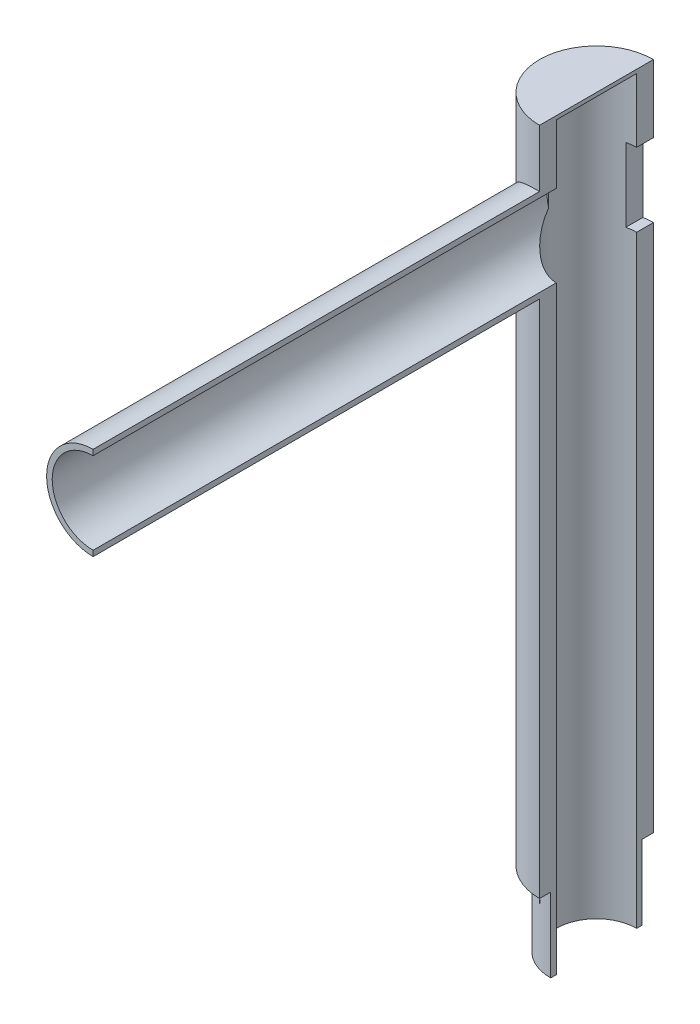
from build123d import *

# Parameters (mm, degrees)
SKETCH1_W                = 15.3
SKETCH1_H                = 180
SKETCH1_W_2              = 12.3
SKETCH1_H_2              = 20
BOSS_EXTRUDE1_DEPTH      = 120
BOSS_EXTRUDE1_DEPTH_BACK = 9
SKETCH4_R                = 12.5
BOSS_EXTRUDE2_START      = -25
SKETCH6_W                = 40
SKETCH6_H                = 18
SKETCH6_W_2              = 36
SKETCH6_H_2              = 14
BOSS_EXTRUDE2_DEPTH      = 10
SKETCH2_R                = 10.8
CUT_EXTRUDE1_DEPTH       = 199
SKETCH5_R                = 11
CUT_EXTRUDE2_DEPTH       = 133
SKETCH7_W                = 36
SKETCH7_H                = 14
CUT_EXTRUDE3_DEPTH       = 15
BOSS_EXTRUDE3_START      = -11
SKETCH8_W                = 5.5
SKETCH8_H                = 22
BOSS_EXTRUDE3_DEPTH      = 6
SKETCH9_R                = 1.75
BOSS_EXTRUDE4_DEPTH      = 2
SKETCH10_W               = 36
SKETCH10_H               = 14
SKETCH10_R               = 4
BOSS_EXTRUDE5_DEPTH      = 1
CUT_EXTRUDE5_DEPTH       = 215


with BuildPart() as part:
    # Sketch1 → Revolve1 (revolve)
    with BuildSketch(Plane.XY, mode=Mode.PRIVATE) as revolve1_sk:
        with Locations((-7.65, 90)):
            Rectangle(SKETCH1_W, SKETCH1_H)
        with Locations((-6.15, -10)):
            Rectangle(SKETCH1_W_2, SKETCH1_H_2)
    revolve(revolve1_sk.sketch.rotate(Axis((0, 259.808396335, 0), (0, -1, 0)), 270), axis=Axis((0, 259.808396335, 0), (0, -1, 0)))

    # Sketch4 → Boss-Extrude1 (add, two sides: drawn at the far end of the back side and taken through both)
    with BuildSketch(Plane.XY.offset(15.3).offset(-BOSS_EXTRUDE1_DEPTH_BACK)):
        with Locations((0, 152.071263422)):
            Circle(SKETCH4_R)
    extrude(amount=BOSS_EXTRUDE1_DEPTH + BOSS_EXTRUDE1_DEPTH_BACK)

    # Sketch6 → Boss-Extrude2 (add)
    with BuildSketch(Plane.ZY.offset(12.5).offset(BOSS_EXTRUDE2_START)):
        with Locations((115.3, 152.071263422)):
            Rectangle(SKETCH6_W, SKETCH6_H)
        with Locations((115.3, 152.071263422)):
            Rectangle(SKETCH6_W_2, SKETCH6_H_2, mode=Mode.SUBTRACT)
    extrude(amount=BOSS_EXTRUDE2_DEPTH)

    # Sketch2 → Cut-Extrude1 (cut)
    with BuildSketch(Plane.XZ.offset(20)):
        with Locations(Location((0, 0, 0), (0, 0, 270))):
            Circle(SKETCH2_R)
    extrude(amount=-CUT_EXTRUDE1_DEPTH, mode=Mode.SUBTRACT)

    # Sketch5 → Cut-Extrude2 (cut)
    with BuildSketch(Plane.XY.offset(135.3)):
        with Locations((0, 152.071263422)):
            Circle(SKETCH5_R)
    extrude(amount=-CUT_EXTRUDE2_DEPTH, mode=Mode.SUBTRACT)

    # Sketch7 → Cut-Extrude3 (cut)
    with BuildSketch(Plane(origin=(12.5, 0, 0), x_dir=(0, 0, -1), z_dir=(1, 0, 0))):
        with Locations((-115.3, 152.071263422)):
            Rectangle(SKETCH7_W, SKETCH7_H)
    extrude(amount=-CUT_EXTRUDE3_DEPTH, mode=Mode.SUBTRACT)

    # Sketch8 → Boss-Extrude3 (add)
    with BuildSketch(Plane.XY.offset(97.3).offset(BOSS_EXTRUDE3_START)):
        with Locations((2.75, 152.071263422)):
            Rectangle(SKETCH8_W, SKETCH8_H)
        with BuildLine():
            ThreePointArc((8.485281374, 159.071263422), (7.105810702, 160.468135117), (5.5, 161.597542863))
            Line((5.5, 161.597542863), (5.5, 142.54498398))
            ThreePointArc((5.5, 142.54498398), (7.105810702, 143.674391726), (8.485281374, 145.071263422))
            ThreePointArc((8.485281374, 145.071263422), (11, 152.071263422), (8.485281374, 159.071263422))
        make_face()
    extrude(amount=-BOSS_EXTRUDE3_DEPTH)

    # Sketch9 → Boss-Extrude4 (add)
    with BuildSketch(Plane.ZY):
        with Locations((83.05, 159.671263422)):
            Circle(SKETCH9_R)
        with Locations(Location((83.05, 144.471263422, 0), (0, 0, 180))):
            Circle(SKETCH9_R)
    extrude(amount=BOSS_EXTRUDE4_DEPTH)

    # Sketch10 → Boss-Extrude5 (add)
    with BuildSketch(Plane(origin=(12.5, 0, 0), x_dir=(0, 0, -1), z_dir=(1, 0, 0))):
        with Locations((-115.3, 152.071263422)):
            Rectangle(SKETCH10_W, SKETCH10_H)
        with Locations((-127.3, 152.071263422)):
            Circle(SKETCH10_R, mode=Mode.SUBTRACT)
        with Locations((-115.3, 152.071263422)):
            Circle(SKETCH10_R, mode=Mode.SUBTRACT)
        with Locations((-103.3, 152.071263422)):
            Circle(SKETCH10_R, mode=Mode.SUBTRACT)
    extrude(amount=-BOSS_EXTRUDE5_DEPTH)

    # Sketch12 → Cut-Extrude5 (cut)
    with BuildSketch(Plane.XY.offset(135.3)):
        with BuildLine():
            Line((15.3, 180), (0, 180))
            Line((0, 180), (0, 164.571263422))
            ThreePointArc((0, 164.571263422), (4.677071733, 163.663286541), (8.674675786, 161.071263422))
            Line((8.674675786, 161.071263422), (12.5, 161.071263422))
            Line((12.5, 161.071263422), (12.5, 143.071263422))
            Line((12.5, 143.071263422), (8.674675786, 143.071263422))
            ThreePointArc((8.674675786, 143.071263422), (4.677071733, 140.479240302), (0, 139.571263422))
            Line((0, 139.571263422), (0, -20))
            Line((0, -20), (15.3, -20))
            Line((15.3, -20), (15.3, 180))
        make_face()
        with BuildLine():
            ThreePointArc((8.674675786, 161.071263422), (4.677071733, 163.663286541), (0, 164.571263422))
            Line((0, 164.571263422), (0, 163.071263422))
            ThreePointArc((0, 163.071263422), (7.778174593, 159.849438015), (11, 152.071263422))
            ThreePointArc((11, 152.071263422), (7.778174593, 144.293088829), (0, 141.071263422))
            Line((0, 141.071263422), (0, 139.571263422))
            ThreePointArc((0, 139.571263422), (4.677071733, 140.479240302), (8.674675786, 143.071263422))
            Line((8.674675786, 143.071263422), (12.5, 143.071263422))
            Line((12.5, 143.071263422), (12.5, 161.071263422))
            Line((12.5, 161.071263422), (8.674675786, 161.071263422))
        make_face()
        with BuildLine():
            ThreePointArc((11, 152.071263422), (7.778174593, 159.849438015), (0, 163.071263422))
            Line((0, 163.071263422), (0, 161.806579982))
            Line((0, 161.806579982), (-2.604703903, 161.806579982))
            Line((-2.604703903, 161.806579982), (-2.604703903, 142.047887239))
            Line((-2.604703903, 142.047887239), (0, 142.047887239))
            Line((0, 142.047887239), (0, 141.071263422))
            ThreePointArc((0, 141.071263422), (7.778174593, 144.293088829), (11, 152.071263422))
        make_face()
    extrude(amount=-CUT_EXTRUDE5_DEPTH, mode=Mode.SUBTRACT)


solid = part.part
